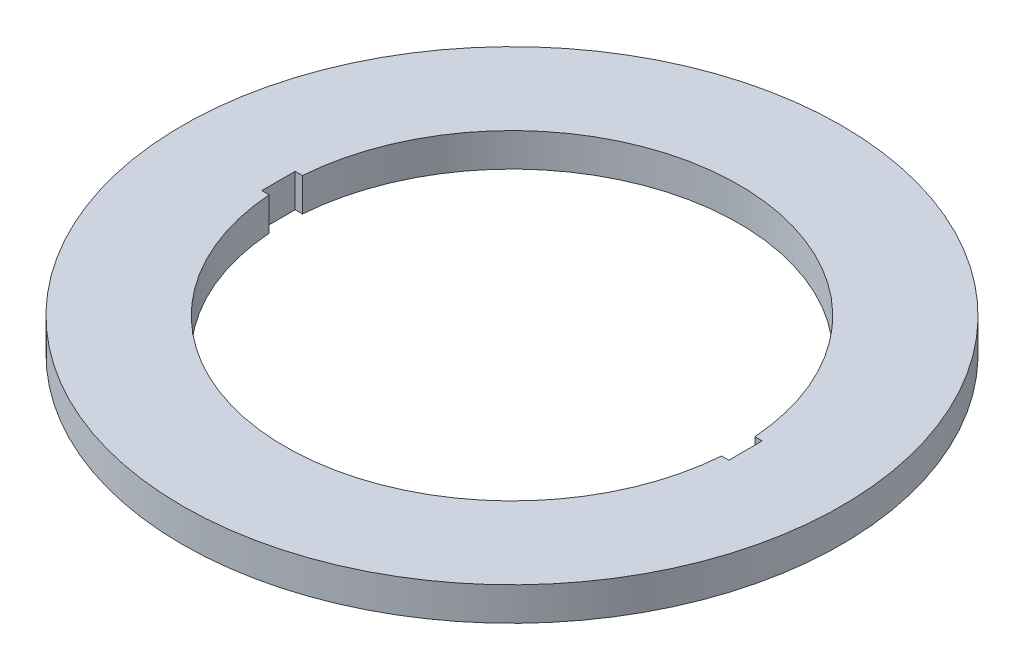
from build123d import *

# Parameters (mm, degrees)
SKETCH1_R           = 31.369
BOSS_EXTRUDE1_DEPTH = 3.175


with BuildPart() as part:
    # Sketch1 → Boss-Extrude1 (new body)
    with BuildSketch(Plane(origin=(0, 0, 0), x_dir=(1, 0, 0), z_dir=(0, 1, 0))):
        with Locations(Location((0, 0, 0), (0, 0, 270))):
            Circle(SKETCH1_R)
        with BuildLine():
            Line((-22.225, 1.5875), (-21.531556928, 1.5875))
            ThreePointArc((-21.531556928, 1.5875), (0, 21.59), (21.531556928, 1.5875))
            Line((21.531556928, 1.5875), (22.225, 1.5875))
            Line((22.225, 1.5875), (22.225, -1.5875))
            Line((22.225, -1.5875), (21.531556928, -1.5875))
            ThreePointArc((21.531556928, -1.5875), (0, -21.59), (-21.531556928, -1.5875))
            Line((-21.531556928, -1.5875), (-22.225, -1.5875))
            Line((-22.225, -1.5875), (-22.225, 1.5875))
        make_face(mode=Mode.SUBTRACT)
    extrude(amount=BOSS_EXTRUDE1_DEPTH)


solid = part.part
